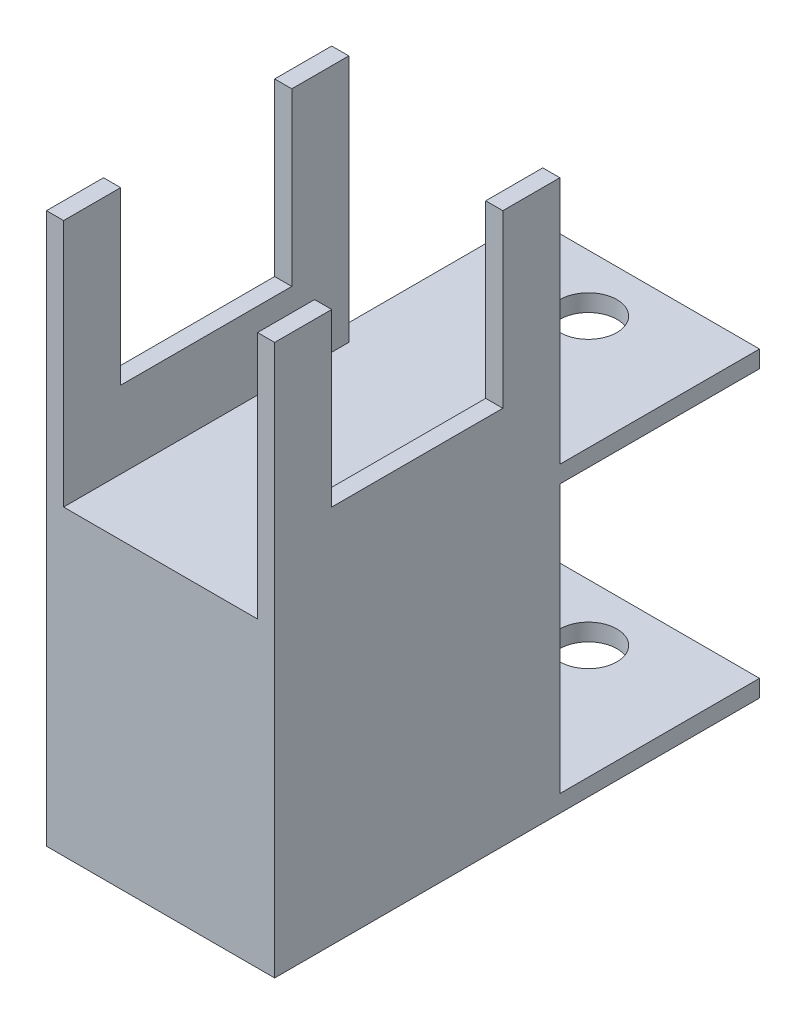
from build123d import *

# Parameters (mm, degrees)
AUFSATZ_LINEAR_AUSTRAGEN1_DEPTH      = 20
SKIZZE2_W                            = 34
SKIZZE2_H                            = 43.5
SCHNITT_LINEAR_AUSTRAGEN1_DEPTH      = 105.522724802
SCHNITT_LINEAR_AUSTRAGEN2_DEPTH      = 105.522724802
SCHNITT_LINEAR_AUSTRAGEN2_DEPTH_BACK = 105.522724802
SKIZZE3_R                            = 5


with BuildPart() as part:
    # Skizze1 → Aufsatz-Linear austragen1 (new, symmetric)
    with BuildSketch(Plane(origin=(0, 0, 0), x_dir=(0, 0, -1), z_dir=(1, 0, 0))):
        Polygon((-25, 23.5), (10, 23.5), (10, 26.5), (-25, 26.5), (-25, 70), (-35, 70), (-35, 40), (-65, 40), (-65, 70), (-75, 70), (-75, -26.5), (10, -26.5), (10, -23.5), (-25, -23.5), align=None)
    extrude(amount=AUFSATZ_LINEAR_AUSTRAGEN1_DEPTH, both=True)

    # Skizze2 → Schnitt-Linear austragen1 (cut, through all)
    with BuildSketch(Plane.XY):
        with Locations((0, 48.25)):
            Rectangle(SKIZZE2_W, SKIZZE2_H)
    extrude(amount=SCHNITT_LINEAR_AUSTRAGEN1_DEPTH, mode=Mode.SUBTRACT)

    # Skizze3 → Schnitt-Linear austragen2 (cut, two sides: drawn at the far end of the back side and taken through both)
    with BuildSketch(Plane(origin=(0, 0, 0), x_dir=(1, 0, 0), z_dir=(0, 1, 0)).offset(-SCHNITT_LINEAR_AUSTRAGEN2_DEPTH_BACK)):
        with Locations(Location((0, 0, 0), (0, 0, 270))):
            Circle(SKIZZE3_R)
    extrude(amount=SCHNITT_LINEAR_AUSTRAGEN2_DEPTH + SCHNITT_LINEAR_AUSTRAGEN2_DEPTH_BACK, mode=Mode.SUBTRACT)


solid = part.part
